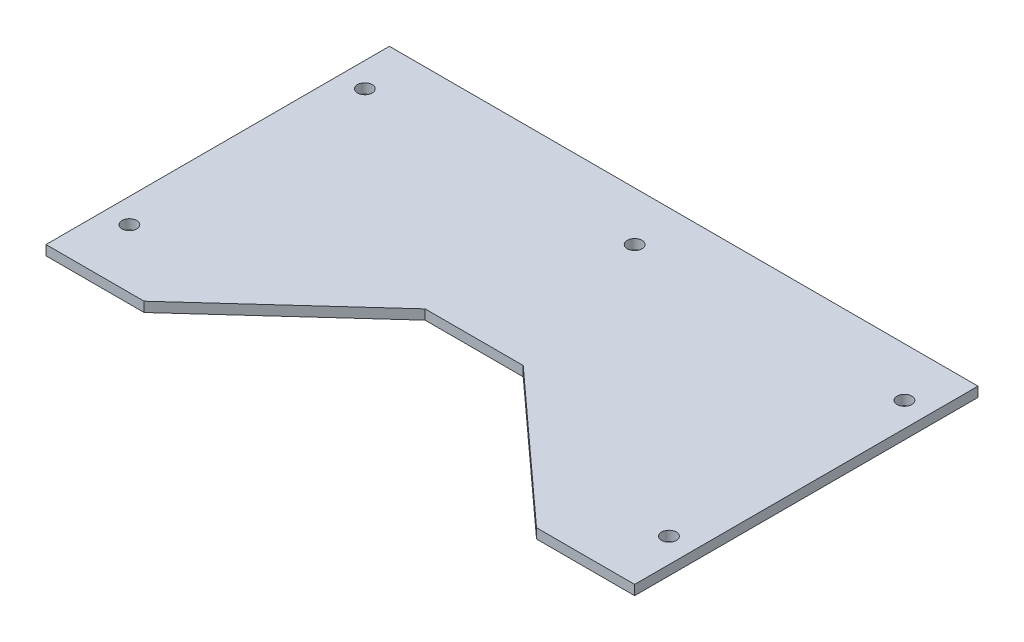
from build123d import *

# Parameters (mm, degrees)
SKETCH1_R           = 1.905
BOSS_EXTRUDE1_DEPTH = 1.27


with BuildPart() as part:
    # Sketch1 → Boss-Extrude1 (new, symmetric)
    with BuildSketch(Plane(origin=(0, 0, 0), x_dir=(1, 0, 0), z_dir=(0, 1, 0))):
        Polygon((-76.2, 39.789919355), (76.2, 39.789919355), (76.2, -49.110080645), (50.8, -49.110080645), (12.7, -14.458198925), (-12.7, -14.458198925), (-50.8, -49.110080645), (-76.2, -49.110080645), align=None)
        with Locations(Location((69.85, 27.089919355, 0), (0, 0, 270))):
            Circle(SKETCH1_R, mode=Mode.SUBTRACT)
        with Locations(Location((0, 27.089919355, 0), (0, 0, 270))):
            Circle(SKETCH1_R, mode=Mode.SUBTRACT)
        with Locations(Location((-69.85, 27.089919355, 0), (0, 0, 270))):
            Circle(SKETCH1_R, mode=Mode.SUBTRACT)
        with Locations(Location((69.85, -33.870080645, 0), (0, 0, 270))):
            Circle(SKETCH1_R, mode=Mode.SUBTRACT)
        with Locations(Location((-69.85, -33.870080645, 0), (0, 0, 270))):
            Circle(SKETCH1_R, mode=Mode.SUBTRACT)
    extrude(amount=BOSS_EXTRUDE1_DEPTH, both=True)


solid = part.part
